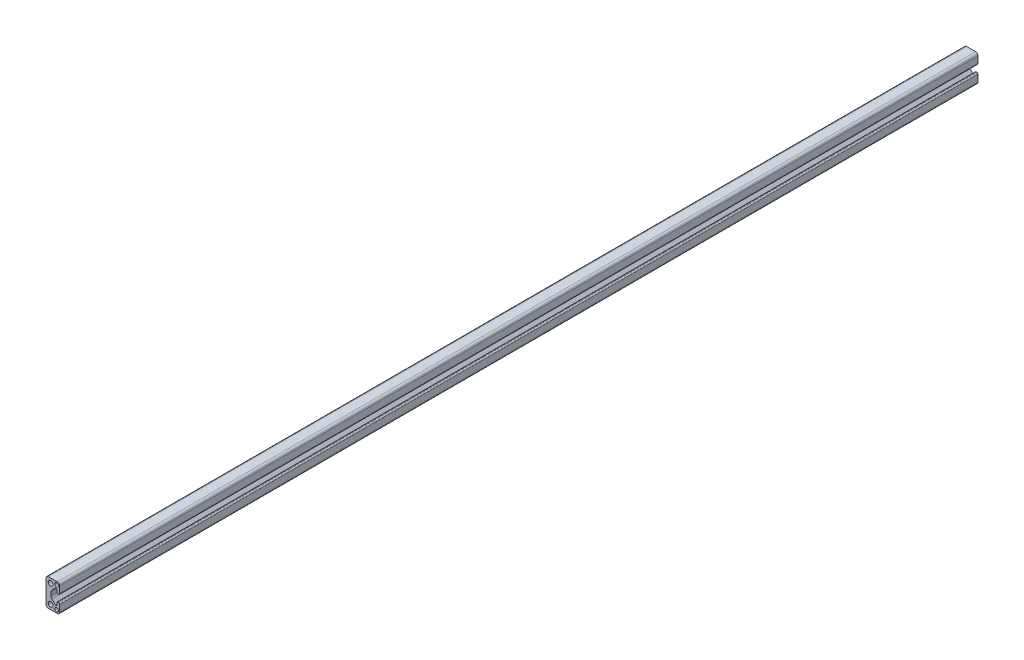
from build123d import *

# Parameters (mm, degrees)
SKETCH3_R           = 2.201333333
SKETCH3_R_2         = 1.693333333
BOSS_EXTRUDE1_DEPTH = 914.4
CUT_EXTRUDE1_DEPTH  = 977.9


with BuildPart() as part:
    # Sketch3 → Boss-Extrude1 (new, symmetric)
    with BuildSketch(Plane.XY):
        with BuildLine():
            Line((-1.778, 0), (-1.778, 1.27))
            ThreePointArc((-1.778, 1.27), (-1.536070654, 2.494011801), (-0.846666667, 3.533942971))
            Line((-0.846666667, 3.533942971), (2.413267273, 6.793876912))
            ThreePointArc((2.413267273, 6.793876912), (2.578074335, 6.903997469), (2.772477518, 6.942666667))
            Line((2.772477518, 6.942666667), (3.048, 6.942666667))
            ThreePointArc((3.048, 6.942666667), (3.467078619, 6.769078619), (3.640666667, 6.35))
            Line((3.640666667, 6.35), (3.640666667, 4.301066667))
            ThreePointArc((3.640666667, 4.301066667), (3.948165494, 3.558698827), (4.690533333, 3.2512))
            Line((4.690533333, 3.2512), (5.300133333, 3.2512))
            ThreePointArc((5.300133333, 3.2512), (6.042501173, 3.558698827), (6.35, 4.301066667))
            Line((6.35, 4.301066667), (6.35, 10.583333333))
            ThreePointArc((6.35, 10.583333333), (5.730042687, 12.080042687), (4.233333333, 12.7))
            Line((4.233333333, 12.7), (-4.233333333, 12.7))
            ThreePointArc((-4.233333333, 12.7), (-5.730042687, 12.080042687), (-6.35, 10.583333333))
            Line((-6.35, 10.583333333), (-6.35, 0))
            Line((-6.35, 0), (-1.778, 0))
        make_face()
        with Locations(Location((-2.116666667, 8.466666667, 0), (0, 0, 180))):
            Circle(SKETCH3_R, mode=Mode.SUBTRACT)
        with Locations(Location((3.429, 9.906, 0), (0, 0, 180))):
            Circle(SKETCH3_R_2, mode=Mode.SUBTRACT)
    extrude(amount=BOSS_EXTRUDE1_DEPTH, both=True)

    # Mirror1: part across plane


with BuildPart() as part_1:
    add(part.part)
    add(part.part.mirror(Plane.ZX))

    # Sketch4 → Cut-Extrude1 (cut)
    with BuildSketch(Plane.XY.offset(914.4)):
        with BuildLine():
            Line((-6.35, 10.583333333), (-6.35, -10.583333333))
            ThreePointArc((-6.35, -10.583333333), (-5.730042687, -12.080042687), (-4.233333333, -12.7))
            Line((-4.233333333, -12.7), (4.233333333, -12.7))
            ThreePointArc((4.233333333, -12.7), (5.730042687, -12.080042687), (6.35, -10.583333333))
            Line((6.35, -10.583333333), (6.35, -4.301066667))
            ThreePointArc((6.35, -4.301066667), (6.042501173, -3.558698827), (5.300133333, -3.2512))
            Line((5.300133333, -3.2512), (4.690533333, -3.2512))
            ThreePointArc((4.690533333, -3.2512), (3.948165494, -3.558698827), (3.640666667, -4.301066667))
            Line((3.640666667, -4.301066667), (3.640666667, -6.35))
            ThreePointArc((3.640666667, -6.35), (3.467078619, -6.769078619), (3.048, -6.942666667))
            Line((3.048, -6.942666667), (2.772477518, -6.942666667))
            ThreePointArc((2.772477518, -6.942666667), (2.578074335, -6.903997469), (2.413267273, -6.793876912))
            Line((2.413267273, -6.793876912), (-0.846666667, -3.533942971))
            ThreePointArc((-0.846666667, -3.533942971), (-1.536070654, -2.494011801), (-1.778, -1.27))
            Line((-1.778, -1.27), (-1.778, 1.27))
            ThreePointArc((-1.778, 1.27), (-1.536070654, 2.494011801), (-0.846666667, 3.533942971))
            Line((-0.846666667, 3.533942971), (2.413267273, 6.793876912))
            ThreePointArc((2.413267273, 6.793876912), (2.578074335, 6.903997469), (2.772477518, 6.942666667))
            Line((2.772477518, 6.942666667), (3.048, 6.942666667))
            ThreePointArc((3.048, 6.942666667), (3.467078619, 6.769078619), (3.640666667, 6.35))
            Line((3.640666667, 6.35), (3.640666667, 4.301066667))
            ThreePointArc((3.640666667, 4.301066667), (3.948165494, 3.558698827), (4.690533333, 3.2512))
            Line((4.690533333, 3.2512), (5.300133333, 3.2512))
            ThreePointArc((5.300133333, 3.2512), (6.042501173, 3.558698827), (6.35, 4.301066667))
            Line((6.35, 4.301066667), (6.35, 10.583333333))
            ThreePointArc((6.35, 10.583333333), (5.730042687, 12.080042687), (4.233333333, 12.7))
            Line((4.233333333, 12.7), (-4.233333333, 12.7))
            ThreePointArc((-4.233333333, 12.7), (-5.730042687, 12.080042687), (-6.35, 10.583333333))
        make_face()
    extrude(amount=-CUT_EXTRUDE1_DEPTH, mode=Mode.SUBTRACT)


solid = part_1.part
